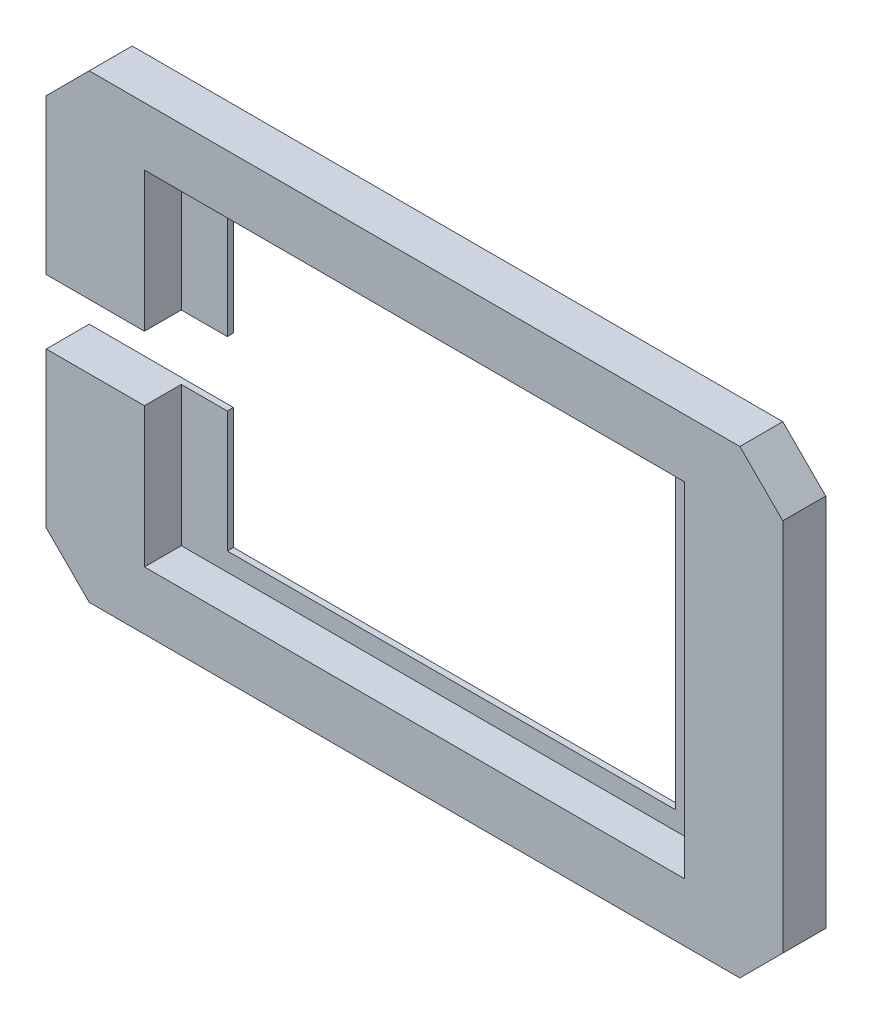
from build123d import *

# Parameters (mm, degrees)
CROQUIS1_W              = 120
CROQUIS1_H              = 75
SALIENTE_EXTRUIR1_DEPTH = 7
CROQUIS2_W              = 73
CROQUIS2_H              = 50
CORTAR_EXTRUIR1_DEPTH   = 15
CROQUIS3_W              = 88
CROQUIS3_H              = 56
CORTAR_EXTRUIR2_DEPTH   = 6
CROQUIS4_W              = 23.5
CROQUIS4_H              = 10.5
CORTAR_EXTRUIR3_DEPTH   = 25
CHAFL_N3_SIZE           = 7


with BuildPart() as part:
    # Croquis1 → Saliente-Extruir1 (new body)
    with BuildSketch(Plane.XY):
        Rectangle(CROQUIS1_W, CROQUIS1_H)
    extrude(amount=SALIENTE_EXTRUIR1_DEPTH)

    # Croquis2 → Cortar-Extruir1 (cut)
    with BuildSketch(Plane(origin=(0, 0, 0), x_dir=(-1, 0, 0), z_dir=(0, 0, -1))):
        Rectangle(CROQUIS2_W, CROQUIS2_H)
    extrude(amount=-CORTAR_EXTRUIR1_DEPTH, mode=Mode.SUBTRACT)

    # Croquis3 → Cortar-Extruir2 (cut)
    with BuildSketch(Plane.XY.offset(7)):
        Rectangle(CROQUIS3_W, CROQUIS3_H)
    extrude(amount=-CORTAR_EXTRUIR2_DEPTH, mode=Mode.SUBTRACT)

    # Croquis4 → Cortar-Extruir3 (cut)
    with BuildSketch(Plane(origin=(0, 0, 0), x_dir=(-1, 0, 0), z_dir=(0, 0, -1))):
        with Locations((48.25, 0)):
            Rectangle(CROQUIS4_W, CROQUIS4_H)
    extrude(amount=-CORTAR_EXTRUIR3_DEPTH, mode=Mode.SUBTRACT)

    # Chaflán3
    chafl_n3_edges = [part.edges().sort_by_distance(p)[0] for p in [
        (-60, 37.5, 3.5),
        (60, 37.5, 3.5),
        (60, -37.5, 3.5),
        (-60, -37.5, 3.5),
    ]]
    chamfer(chafl_n3_edges, length=CHAFL_N3_SIZE)


solid = part.part
